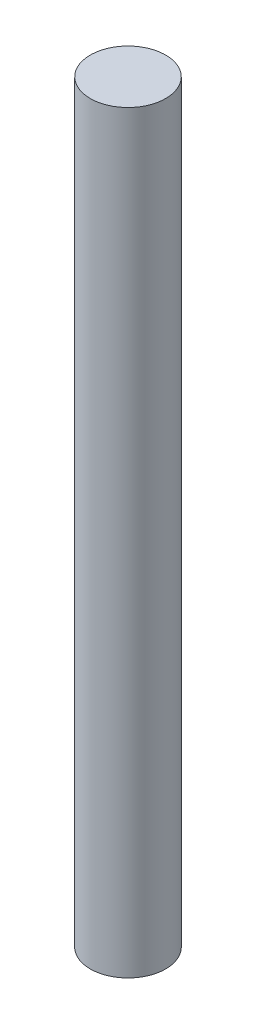
from build123d import *

# Parameters (mm, degrees)
SKETCH_1_R      = 1.5
EXTRUDE_1_DEPTH = 30


with BuildPart() as part:
    # 草图1 → 凸台-拉伸1 (new body)
    with BuildSketch(Plane(origin=(0, 0, 0), x_dir=(1, 0, 0), z_dir=(0, 1, 0))):
        with Locations(Location((-7.250129683, 1.843253309, 0), (0, 0, 270))):
            Circle(SKETCH_1_R)
    extrude(amount=EXTRUDE_1_DEPTH)


solid = part.part
